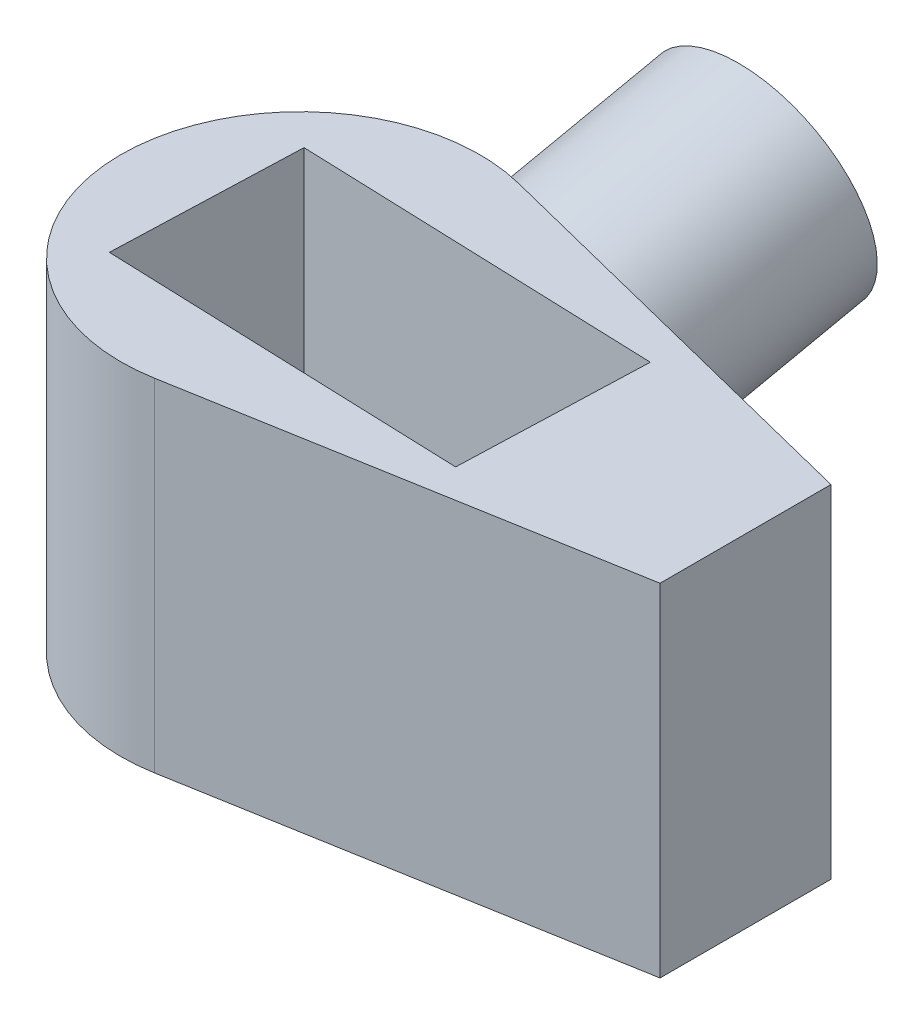
from build123d import *

# Parameters (mm, degrees)
CROQUIS1_R              = 21
SALIENTE_EXTRUIR1_DEPTH = 40
SALIENTE_EXTRUIR2_DEPTH = 40
SALIENTE_EXTRUIR3_REACH = 77.493
CROQUIS3_R              = 13.5
CROQUIS3_R_2            = 10
CROQUIS7_R              = 8.227269221
CROQUIS7_R_2            = 6
CORTAR_EXTRUIR6_DEPTH   = 6
CROQUIS8_R              = 6
CORTAR_EXTRUIR7_DEPTH   = 72.223648425
CORTAR_EXTRUIR8_START   = -25
CORTAR_EXTRUIR8_DEPTH   = 25
CROQUIS12_R             = 9.55
CORTAR_EXTRUIR9_DEPTH   = 5.5


with BuildPart() as part:
    # Croquis1 → Saliente-Extruir1 (new body)
    with BuildSketch(Plane(origin=(0, 0, 0), x_dir=(1, 0, 0), z_dir=(0, 1, 0))):
        with Locations(Location((0, 0, 0), (0, 0, 270))):
            Circle(CROQUIS1_R)
    extrude(amount=SALIENTE_EXTRUIR1_DEPTH)

    # Croquis2 → Saliente-Extruir2 (add)
    with BuildSketch(Plane(origin=(0, 0, 0), x_dir=(1, 0, 0), z_dir=(0, 1, 0))):
        with BuildLine():
            Line((53.975127576, 8.110971331), (53.975127576, -11.889028669))
            Line((53.975127576, -11.889028669), (3.613793412, -20.686722727))
            ThreePointArc((3.613793412, -20.686722727), (20.98607707, -0.764571273), (5.109545014, 20.368911354))
            Line((5.109545014, 20.368911354), (53.975127576, 8.110971331))
        make_face()
    extrude(amount=SALIENTE_EXTRUIR2_DEPTH)

    # Croquis3 → Saliente-Extruir3 (add, up to next)
    with BuildSketch(Plane(origin=(5.109545014, 0, -20.368911354), x_dir=(-0.9699481597219111, 0, -0.24331166731597212), z_dir=(0.2433116673159721, 0, -0.969948159721911)), mode=Mode.PRIVATE) as saliente_extruir3_sk1:
        with Locations((0, 20)):
            Circle(CROQUIS3_R)
        with Locations((0, 20)):
            Circle(CROQUIS3_R_2, mode=Mode.SUBTRACT)
    saliente_extruir3_tool1 = extrude(saliente_extruir3_sk1.sketch, amount=-SALIENTE_EXTRUIR3_REACH, mode=Mode.PRIVATE) - part.part
    add(saliente_extruir3_tool1.solids().sort_by_distance((17.833482, 20, -17.177109))[0])

    # Croquis7 → Cortar-Extruir6 (cut)
    with BuildSketch(Plane.XZ):
        with Locations(Location((0, 0, 0), (0, 0, 270))):
            Circle(CROQUIS7_R)
        with Locations(Location((0, 0, 0), (0, 0, 270))):
            Circle(CROQUIS7_R_2, mode=Mode.SUBTRACT)
    extrude(amount=-CORTAR_EXTRUIR6_DEPTH, mode=Mode.SUBTRACT)

    # Croquis8 → Cortar-Extruir7 (cut, through all)
    with BuildSketch(Plane.XZ):
        with Locations(Location((0, 0, 0), (0, 0, 270))):
            Circle(CROQUIS8_R)
    extrude(amount=-CORTAR_EXTRUIR7_DEPTH, mode=Mode.SUBTRACT)

    # Croquis10 → Cortar-Extruir8 (cut)
    with BuildSketch(Plane(origin=(0, 40, 0), x_dir=(1, 0, 0), z_dir=(0, 1, 0)).offset(CORTAR_EXTRUIR8_START)):
        with BuildLine():
            Line((-5.995438853, 0.23390802), (-11.37823559, 0.424457107))
            Line((-11.37823559, 0.424457107), (-11.767631672, -10.575542893))
            Line((-11.767631672, -10.575542893), (30.232368328, -12.062327932))
            Line((30.232368328, -12.062327932), (30.62176441, -1.062327932))
            Line((30.62176441, -1.062327932), (5.996971268, -0.190619027))
            ThreePointArc((5.996971268, -0.190619027), (-0.212264906, -5.996244125), (-5.995438853, 0.23390802))
        make_face()
        with BuildLine():
            Line((-10.988839509, 11.424457107), (-11.37823559, 0.424457107))
            Line((-11.37823559, 0.424457107), (-5.995438853, 0.23390802))
            ThreePointArc((-5.995438853, 0.23390802), (0.116976243, 5.998859605), (6, 0))
            ThreePointArc((6, 0), (5.999242769, -0.095321543), (5.996971268, -0.190619027))
            Line((5.996971268, -0.190619027), (30.62176441, -1.062327932))
            Line((30.62176441, -1.062327932), (31.011160491, 9.937672068))
            Line((31.011160491, 9.937672068), (-10.988839509, 11.424457107))
        make_face()
    extrude(amount=CORTAR_EXTRUIR8_DEPTH, mode=Mode.SUBTRACT)

    # Croquis12 → Cortar-Extruir9 (cut)
    with BuildSketch(Plane(origin=(0, 15, 0), x_dir=(1, 0, 0), z_dir=(0, 1, 0))):
        with Locations(Location((0, 0, 0), (0, 0, 270))):
            Circle(CROQUIS12_R)
    extrude(amount=-CORTAR_EXTRUIR9_DEPTH, mode=Mode.SUBTRACT)

    # Croquis4 → Revolución2 (revolve)
    with BuildSketch(Plane(origin=(5.1, 0, 0), x_dir=(0, 0, -1), z_dir=(1, 0, 0))):
        Polygon((23.468699932, 10.900780306), (51.668699932, 16.900780306), (51.668699932, 13.400780306), (16.629031587, 5.945531722), (16.629031587, 9.445531722), align=None)
    revolve(axis=Axis((5.1, 20.900780306, -23.468699932), (0, 0.20810764446485977, -0.9781059289848353)))


solid = part.part
